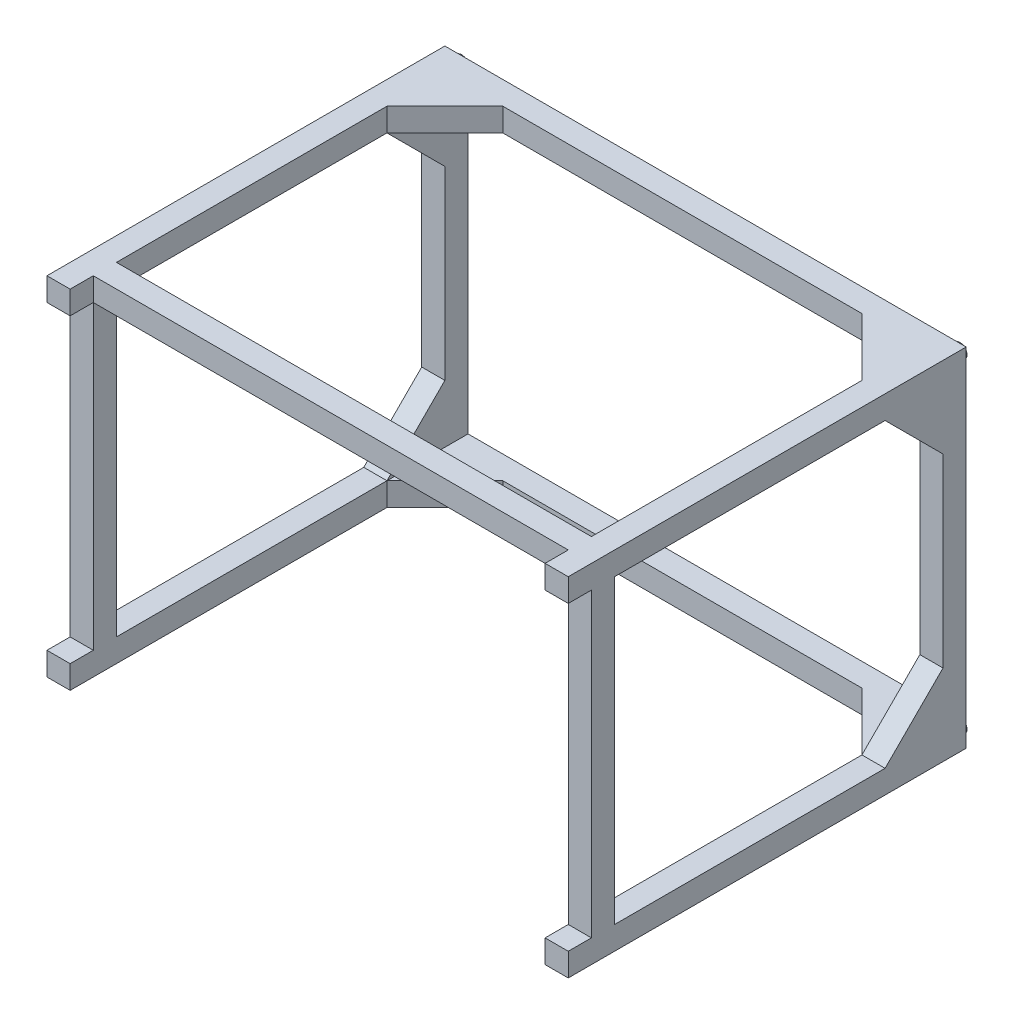
from build123d import *

# Parameters (mm, degrees)
SKETCH1_W            = 40
SKETCH1_H            = 40
BOSS_EXTRUDE1_DEPTH  = 687
SKETCH1_4_W          = 40
SKETCH1_4_H          = 40
BOSS_EXTRUDE2_DEPTH  = 687
SKETCH1_5_W          = 40
SKETCH1_5_H          = 40
BOSS_EXTRUDE3_DEPTH  = 687
SKETCH1_6_W          = 40
SKETCH1_6_H          = 40
BOSS_EXTRUDE4_DEPTH  = 687
SKETCH1_7_W          = 820
SKETCH1_7_H          = 40
BOSS_EXTRUDE5_DEPTH  = 40
SKETCH1_8_W          = 40
SKETCH1_8_H          = 520
BOSS_EXTRUDE6_DEPTH  = 40
SKETCH1_9_W          = 820
SKETCH1_9_H          = 40
BOSS_EXTRUDE7_DEPTH  = 40
SKETCH1_10_W         = 40
SKETCH1_10_H         = 520
BOSS_EXTRUDE8_DEPTH  = 40
BOSS_EXTRUDE9_DEPTH  = 40
BOSS_EXTRUDE10_DEPTH = 40
BOSS_EXTRUDE11_DEPTH = 40
BOSS_EXTRUDE12_DEPTH = 40
SKETCH6_W            = 40
SKETCH6_H            = 40
BOSS_EXTRUDE13_DEPTH = 820
SKETCH7_W            = 40
SKETCH7_H            = 40
BOSS_EXTRUDE14_DEPTH = 520
SKETCH8_W            = 40
SKETCH8_H            = 40
BOSS_EXTRUDE15_DEPTH = 520
SKETCH9_R            = 12.5
BOSS_EXTRUDE16_DEPTH = 9


with BuildPart() as part:
    # Sketch1 → Boss-Extrude1 (new body)
    with BuildSketch(Plane.XY):
        with Locations((20, 580)):
            Rectangle(SKETCH1_W, SKETCH1_H)
    extrude(amount=BOSS_EXTRUDE1_DEPTH)



with BuildPart() as body_2:
    # Sketch1<4> → Boss-Extrude2 (new body)
    with BuildSketch(Plane.XY):
        with Locations((880, 580)):
            Rectangle(SKETCH1_4_W, SKETCH1_4_H)
    extrude(amount=BOSS_EXTRUDE2_DEPTH)


with BuildPart() as body_3:
    # Sketch1<5> → Boss-Extrude3 (new body)
    with BuildSketch(Plane.XY):
        with Locations((20, 20)):
            Rectangle(SKETCH1_5_W, SKETCH1_5_H)
    extrude(amount=BOSS_EXTRUDE3_DEPTH)


with BuildPart() as body_4:
    # Sketch1<6> → Boss-Extrude4 (new body)
    with BuildSketch(Plane.XY):
        with Locations((880, 20)):
            Rectangle(SKETCH1_6_W, SKETCH1_6_H)
    extrude(amount=BOSS_EXTRUDE4_DEPTH)


with BuildPart() as part_1:
    add(part.part)

    add(body_2.part)  # Boss-Extrude5 merges body 2
    # Sketch1<7> → Boss-Extrude5 (add)
    with BuildSketch(Plane.XY):
        with Locations((450, 580)):
            Rectangle(SKETCH1_7_W, SKETCH1_7_H)
    extrude(amount=BOSS_EXTRUDE5_DEPTH)


    add(body_3.part)  # Boss-Extrude6 merges body 3
    # Sketch1<8> → Boss-Extrude6 (add)
    with BuildSketch(Plane.XY):
        with Locations((20, 300)):
            Rectangle(SKETCH1_8_W, SKETCH1_8_H)
    extrude(amount=BOSS_EXTRUDE6_DEPTH)


    add(body_4.part)  # Boss-Extrude7 merges body 4
    # Sketch1<9> → Boss-Extrude7 (add)
    with BuildSketch(Plane.XY):
        with Locations((450, 20)):
            Rectangle(SKETCH1_9_W, SKETCH1_9_H)
    extrude(amount=BOSS_EXTRUDE7_DEPTH)

    # Sketch1<10> → Boss-Extrude8 (add)
    with BuildSketch(Plane.XY):
        with Locations((880, 300)):
            Rectangle(SKETCH1_10_W, SKETCH1_10_H)
    extrude(amount=BOSS_EXTRUDE8_DEPTH)

    # Sketch2 → Boss-Extrude9 (add)
    with BuildSketch(Plane(origin=(0, 600, 0), x_dir=(1, 0, 0), z_dir=(0, 1, 0))):
        Polygon((40, -140), (140, -40), (40, -40), align=None)
        Polygon((760, -40), (860, -140), (860, -40), align=None)
    extrude(amount=-BOSS_EXTRUDE9_DEPTH)

    # Sketch3 → Boss-Extrude10 (add)
    with BuildSketch(Plane.ZY):
        Polygon((40, 560), (40, 460), (140, 560), align=None)
        Polygon((40, 140), (40, 40), (140, 40), align=None)
    extrude(amount=-BOSS_EXTRUDE10_DEPTH)

    # Sketch4 → Boss-Extrude11 (add)
    with BuildSketch(Plane.XZ):
        Polygon((40, 140), (140, 40), (40, 40), align=None)
        Polygon((760, 40), (860, 140), (860, 40), align=None)
    extrude(amount=-BOSS_EXTRUDE11_DEPTH)

    # Sketch5 → Boss-Extrude12 (add)
    with BuildSketch(Plane(origin=(900, 0, 0), x_dir=(0, 0, -1), z_dir=(1, 0, 0))):
        Polygon((-140, 560), (-40, 460), (-40, 560), align=None)
        Polygon((-140, 40), (-40, 40), (-40, 140), align=None)
    extrude(amount=-BOSS_EXTRUDE12_DEPTH)

    # Sketch6 → Boss-Extrude13 (add)
    with BuildSketch(Plane.ZY.offset(-860)):
        with Locations((627, 580)):
            Rectangle(SKETCH6_W, SKETCH6_H)
    extrude(amount=BOSS_EXTRUDE13_DEPTH)

    # Sketch7 → Boss-Extrude14 (add)
    with BuildSketch(Plane.XZ.offset(-560)):
        with Locations((20, 627)):
            Rectangle(SKETCH7_W, SKETCH7_H)
    extrude(amount=BOSS_EXTRUDE14_DEPTH)

    # Sketch8 → Boss-Extrude15 (add)
    with BuildSketch(Plane.XZ.offset(-560)):
        with Locations((880, 627)):
            Rectangle(SKETCH8_W, SKETCH8_H)
    extrude(amount=BOSS_EXTRUDE15_DEPTH)

    # Sketch9 → Boss-Extrude16 (add)
    with BuildSketch(Plane(origin=(0, 0, 0), x_dir=(-1, 0, 0), z_dir=(0, 0, -1))):
        with Locations((-880, 580)):
            Circle(SKETCH9_R)
        with Locations((-880, 20)):
            Circle(SKETCH9_R)
        with Locations((-20, 580)):
            Circle(SKETCH9_R)
        with Locations((-20, 20)):
            Circle(SKETCH9_R)
    extrude(amount=BOSS_EXTRUDE16_DEPTH)


solid = part_1.part
